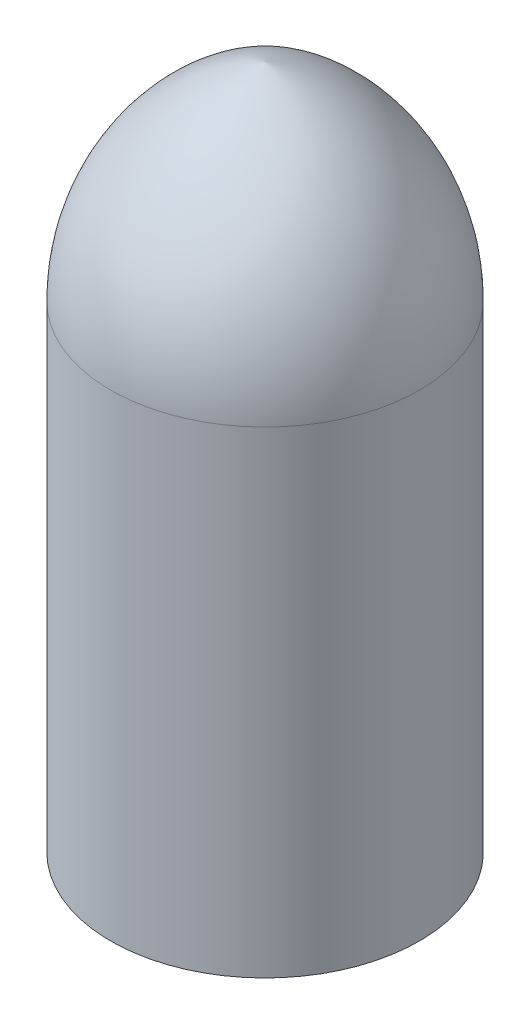
from build123d import *


with BuildPart() as part:
    # Sketch1 → Revolve3 (revolve)
    with BuildSketch(Plane.XY, mode=Mode.PRIVATE) as revolve3_sk:
        with BuildLine():
            Line((52, 0), (55, 0))
            Line((55, 0), (55, 170))
            ThreePointArc((55, 170), (39.73634205, 216.004053635), (0, 243.759689555))
            Line((0, 243.759689555), (0, 240.623917372))
            ThreePointArc((0, 240.623917372), (37.597693385, 213.851276221), (52, 170))
            Line((52, 170), (52, 0))
        make_face()
    revolve(revolve3_sk.sketch.rotate(Axis((0, 240.623917372, 0), (0, 1, 0)), 90), axis=Axis((0, 240.623917372, 0), (0, 1, 0)))


solid = part.part
